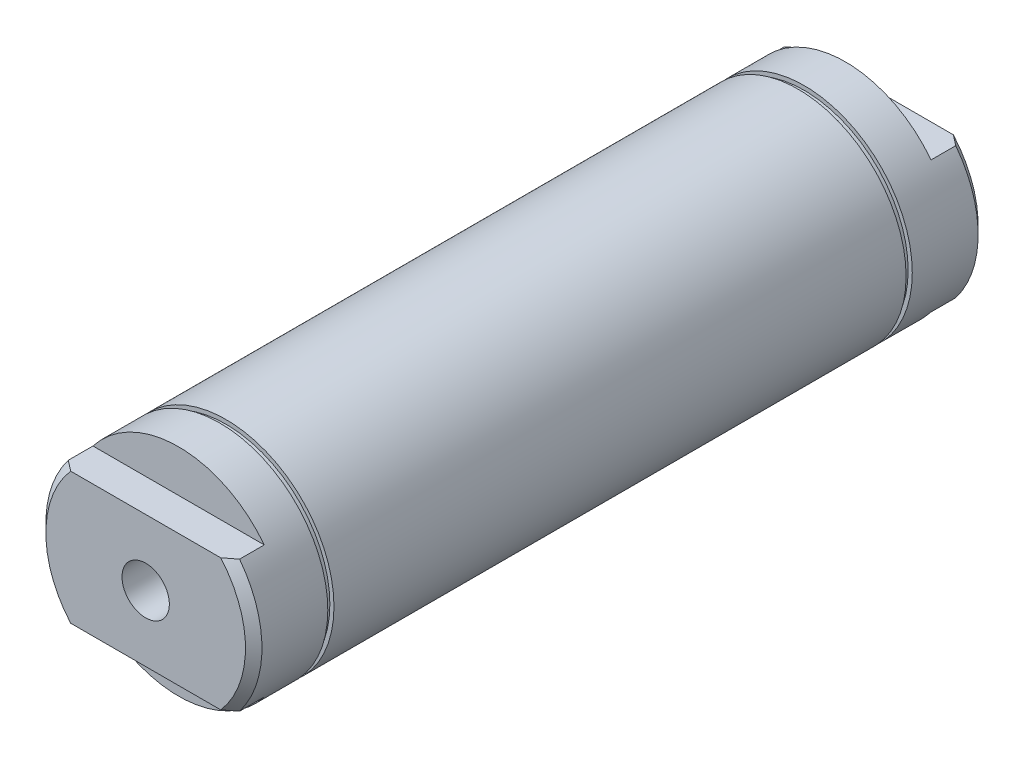
from build123d import *

# Parameters (mm, degrees)
SKETCH1_R           = 26.25
BOSS_EXTRUDE1_DEPTH = 89
CUT_EXTRUDE1_DEPTH  = 8
SKETCH29_W          = 1
SKETCH29_H          = 1.5
CHAMFER1_SIZE       = 2


with BuildPart() as part:
    # Sketch1 → Boss-Extrude1 (new, symmetric)
    with BuildSketch(Plane.XY):
        Circle(SKETCH1_R)
    extrude(amount=BOSS_EXTRUDE1_DEPTH, both=True)

    # Sketch2 → Cut-Extrude1 (cut)
    with BuildSketch(Plane.XY.offset(89)):
        with BuildLine():
            Line((-20.810153772, 16), (20.810153772, 16))
            ThreePointArc((20.810153772, 16), (0, 26.25), (-20.810153772, 16))
        make_face()
        with BuildLine():
            Line((20.810153772, -16), (-20.810153772, -16))
            ThreePointArc((-20.810153772, -16), (0, -26.25), (20.810153772, -16))
        make_face()
    cut_extrude1 = extrude(amount=-CUT_EXTRUDE1_DEPTH, mode=Mode.SUBTRACT)

    # Sketch27 → 1/2-20 Tapped Hole3 (revolve, cut)
    with BuildSketch(Plane(origin=(0, 0, 89), x_dir=(0, -1, 0), z_dir=(1, 0, 0))):
        Polygon((0, 0), (0, 13.45757432), (5.75437, 10), (5.75437, 0), align=None)
    f_1_2_20_tapped_hole3 = revolve(axis=Axis((0, 0, 95.35), (0, 0, -1)), mode=Mode.SUBTRACT)

    # Mirror2: Cut-Extrude1, 1/2-20 Tapped Hole3 across plane
    add(cut_extrude1.mirror(Plane.XY), mode=Mode.SUBTRACT)
    add(f_1_2_20_tapped_hole3.mirror(Plane.XY), mode=Mode.SUBTRACT)

    # Sketch29 → Cut-Revolve1 (revolve, cut)
    with BuildSketch(Plane(origin=(0, 0, 0), x_dir=(1, 0, 0), z_dir=(0, 1, 0)), mode=Mode.PRIVATE) as cut_revolve1_sk:
        with Locations((25.75, 70.25)):
            Rectangle(SKETCH29_W, SKETCH29_H)
    cut_revolve1 = revolve(cut_revolve1_sk.sketch.rotate(Axis((0, 0, 89), (0, 0, -1)), 217.555079253), axis=Axis((0, 0, 89), (0, 0, -1)), mode=Mode.SUBTRACT)

    # Mirror3: Cut-Revolve1 across plane
    add(cut_revolve1.mirror(Plane.XY), mode=Mode.SUBTRACT)

    # Chamfer1
    chamfer1_edges = [part.edges().sort_by_distance(p)[0] for p in [
        (-26.25, 0, -89),
        (24.852857346, -8.449732644, -89),
        (-26.25, 0, 89),
        (24.852857346, 8.449732644, 89),
    ]]
    chamfer(chamfer1_edges, length=CHAMFER1_SIZE)


solid = part.part
